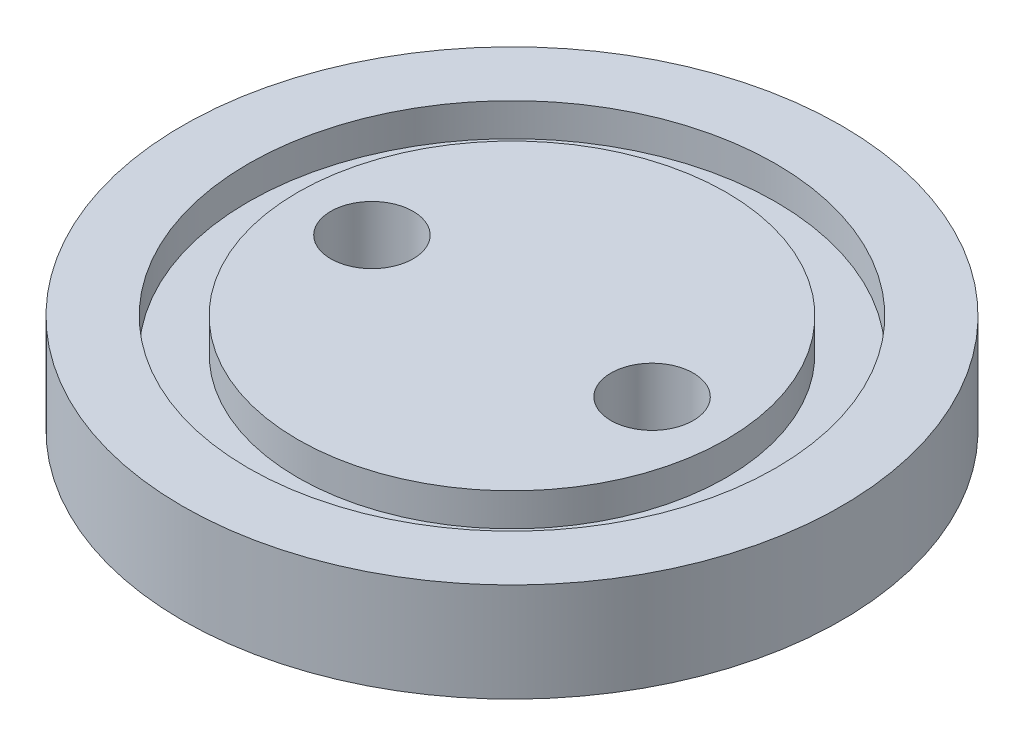
from build123d import *

# Parameters (mm, degrees)
SKETCH1_R           = 10
BOSS_EXTRUDE1_DEPTH = 3
SKETCH3_R           = 8
SKETCH3_R_2         = 6.5
CUT_EXTRUDE1_DEPTH  = 1
SKETCH4_R           = 1.25
CUT_EXTRUDE2_DEPTH  = 15.456832295


with BuildPart() as part:
    # Sketch1 → Boss-Extrude1 (new body)
    with BuildSketch(Plane(origin=(0, 0, 0), x_dir=(1, 0, 0), z_dir=(0, 1, 0))):
        with Locations(Location((0, 0, 0), (0, 0, 270))):
            Circle(SKETCH1_R)
    extrude(amount=BOSS_EXTRUDE1_DEPTH)

    # Sketch3 → Cut-Extrude1 (cut)
    with BuildSketch(Plane(origin=(0, 3, 0), x_dir=(1, 0, 0), z_dir=(0, 1, 0))):
        with Locations(Location((0, 0, 0), (0, 0, 270))):
            Circle(SKETCH3_R)
        with Locations(Location((0, 0, 0), (0, 0, 270))):
            Circle(SKETCH3_R_2, mode=Mode.SUBTRACT)
    extrude(amount=-CUT_EXTRUDE1_DEPTH, mode=Mode.SUBTRACT)

    # Sketch4 → Cut-Extrude2 (cut, through all)
    with BuildSketch(Plane(origin=(0, 0, 0), x_dir=(1, 0, 0), z_dir=(0, 1, 0))):
        with Locations(Location((4.25, 0, 0), (0, 0, 270))):
            Circle(SKETCH4_R)
        with Locations(Location((-4.25, 0, 0), (0, 0, 90))):
            Circle(SKETCH4_R)
    extrude(amount=CUT_EXTRUDE2_DEPTH, mode=Mode.SUBTRACT)


solid = part.part
